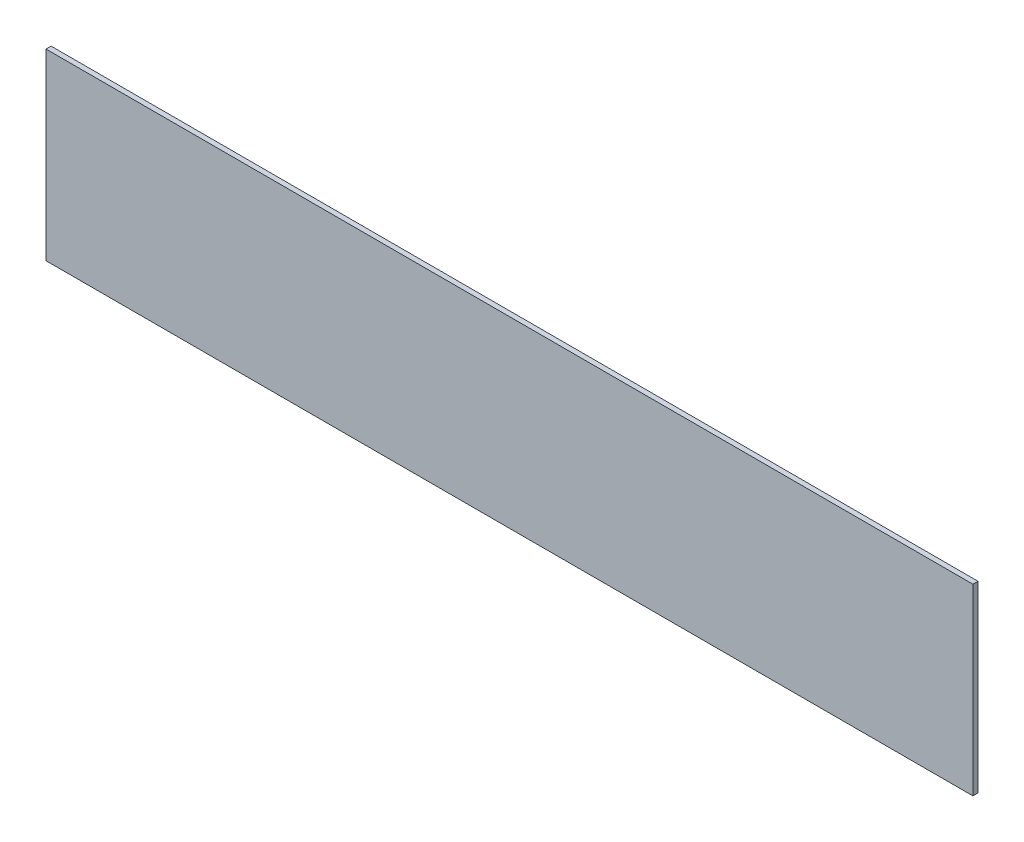
from build123d import *

# Parameters (mm, degrees)
TOPPING_KLAPE_ALT1_KULP_CUKURU_1_START = 26
SKETCH1_W                              = 182
SKETCH1_H                              = 36
TOPPING_KLAPE_ALT1_KULP_CUKURU_1_DEPTH = 1


with BuildPart() as part:
    # Sketch1 → TOPPING_klape_alt1_kulp_cukuru_1 (new body)
    with BuildSketch(Plane.XY.offset(TOPPING_KLAPE_ALT1_KULP_CUKURU_1_START)):
        with Locations((350, 600)):
            Rectangle(SKETCH1_W, SKETCH1_H)
    extrude(amount=TOPPING_KLAPE_ALT1_KULP_CUKURU_1_DEPTH)


solid = part.part
